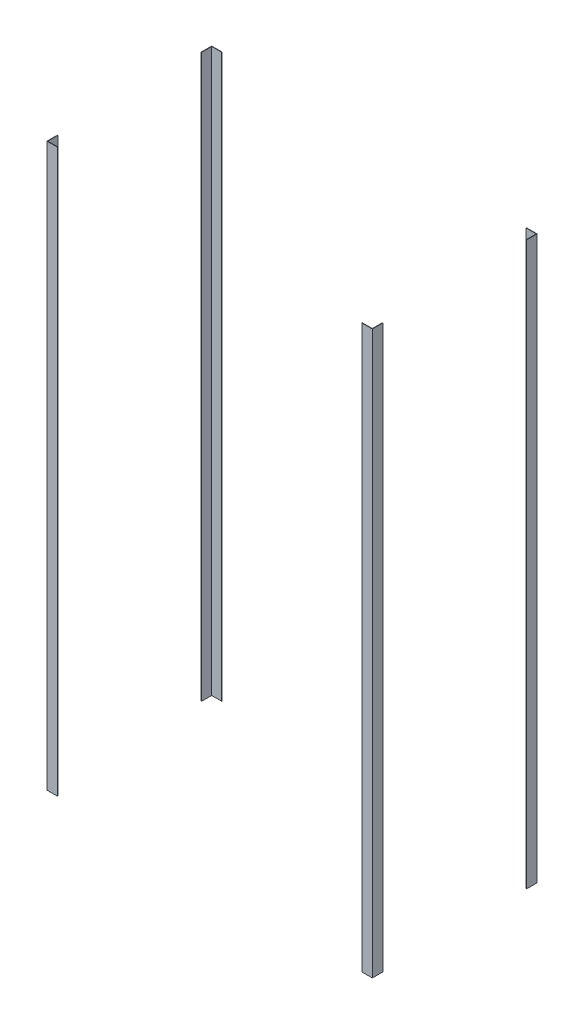
from build123d import *

# Parameters (mm, degrees)
BOSS_EXTRUDE1_DEPTH   = 2133.6
BOSS_EXTRUDE1_2_DEPTH = 2133.6
BOSS_EXTRUDE1_3_DEPTH = 2133.6
BOSS_EXTRUDE1_4_DEPTH = 2133.6


with BuildPart() as part:
    # Sketch1 → Boss-Extrude1 (new body)
    with BuildSketch(Plane(origin=(0, 0, 0), x_dir=(1, 0, 0), z_dir=(0, 1, 0))):
        Polygon((-617.5375, -312.7375), (-577.85, -312.7375), (-577.85, -311.15), (-615.95, -311.15), (-615.95, -273.05), (-617.5375, -273.05), align=None)
    extrude(amount=BOSS_EXTRUDE1_DEPTH)


with BuildPart() as body_2:
    # Sketch1 → Boss-Extrude1 2 (new body)
    with BuildSketch(Plane(origin=(0, 0, 0), x_dir=(1, 0, 0), z_dir=(0, 1, 0))):
        Polygon((-617.5375, 312.7375), (-577.85, 312.7375), (-577.85, 311.15), (-615.95, 311.15), (-615.95, 273.05), (-617.5375, 273.05), align=None)
    extrude(amount=BOSS_EXTRUDE1_2_DEPTH)


with BuildPart() as body_3:
    # Sketch1 → Boss-Extrude1 3 (new body)
    with BuildSketch(Plane(origin=(0, 0, 0), x_dir=(1, 0, 0), z_dir=(0, 1, 0))):
        Polygon((617.5375, -312.7375), (617.5375, -273.05), (615.95, -273.05), (615.95, -311.15), (577.85, -311.15), (577.85, -312.7375), align=None)
    extrude(amount=BOSS_EXTRUDE1_3_DEPTH)


with BuildPart() as body_4:
    # Sketch1 → Boss-Extrude1 4 (new body)
    with BuildSketch(Plane(origin=(0, 0, 0), x_dir=(1, 0, 0), z_dir=(0, 1, 0))):
        Polygon((577.85, 312.7375), (577.85, 311.15), (615.95, 311.15), (615.95, 273.05), (617.5375, 273.05), (617.5375, 312.7375), align=None)
    extrude(amount=BOSS_EXTRUDE1_4_DEPTH)


solid = Compound([part.part, body_2.part, body_3.part, body_4.part])
